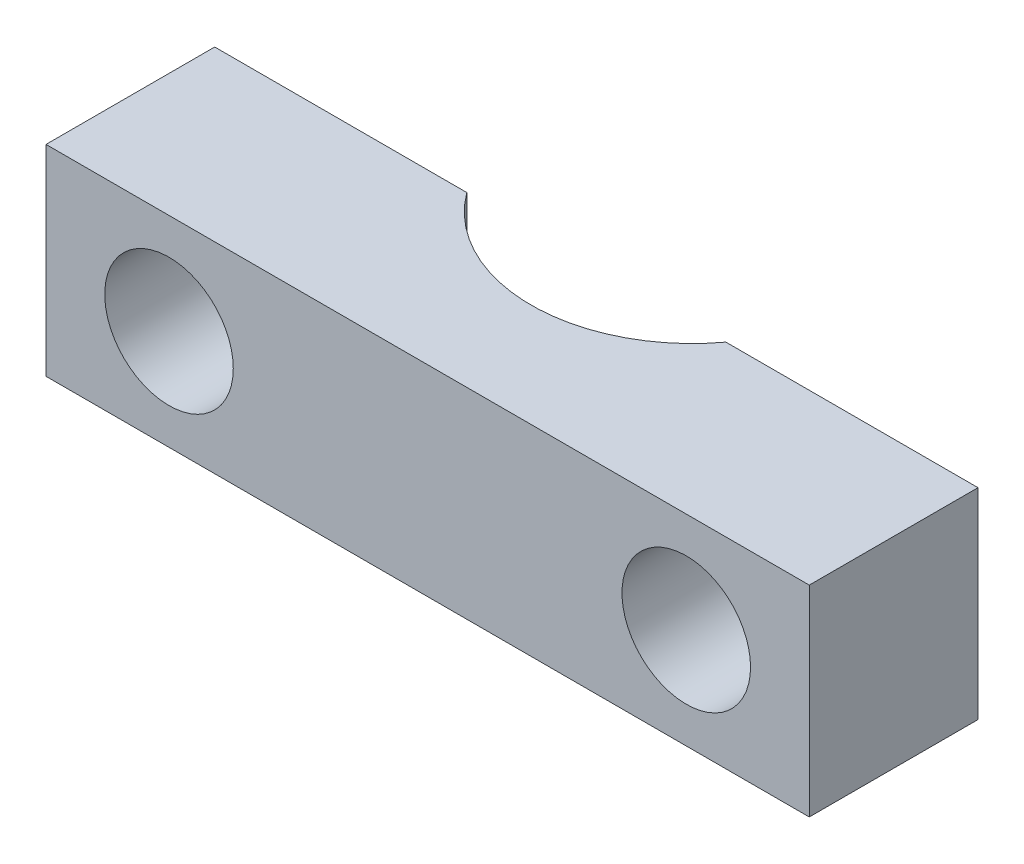
from build123d import *

# Parameters (mm, degrees)
CROQUIS1_W              = 19
CROQUIS1_H              = 5
CROQUIS1_R              = 1.6
SALIENTE_EXTRUIR1_DEPTH = 4.2
CROQUIS2_R              = 4.009695102
CORTAR_EXTRUIR1_DEPTH   = 7.2


with BuildPart() as part:
    # Croquis1 → Saliente-Extruir1 (new body)
    with BuildSketch(Plane.XY):
        with Locations((25.783027827, -30.609692022)):
            Rectangle(CROQUIS1_W, CROQUIS1_H)
        with Locations((19.34510909, -30.609692022)):
            Circle(CROQUIS1_R, mode=Mode.SUBTRACT)
        with Locations((32.220946564, -30.609692022)):
            Circle(CROQUIS1_R, mode=Mode.SUBTRACT)
    extrude(amount=SALIENTE_EXTRUIR1_DEPTH)

    # Croquis2 → Cortar-Extruir1 (cut)
    with BuildSketch(Plane.XZ.offset(33.109692022)):
        with Locations((25.783027827, -2.383165564)):
            Circle(CROQUIS2_R)
    extrude(amount=-CORTAR_EXTRUIR1_DEPTH, mode=Mode.SUBTRACT)


solid = part.part
